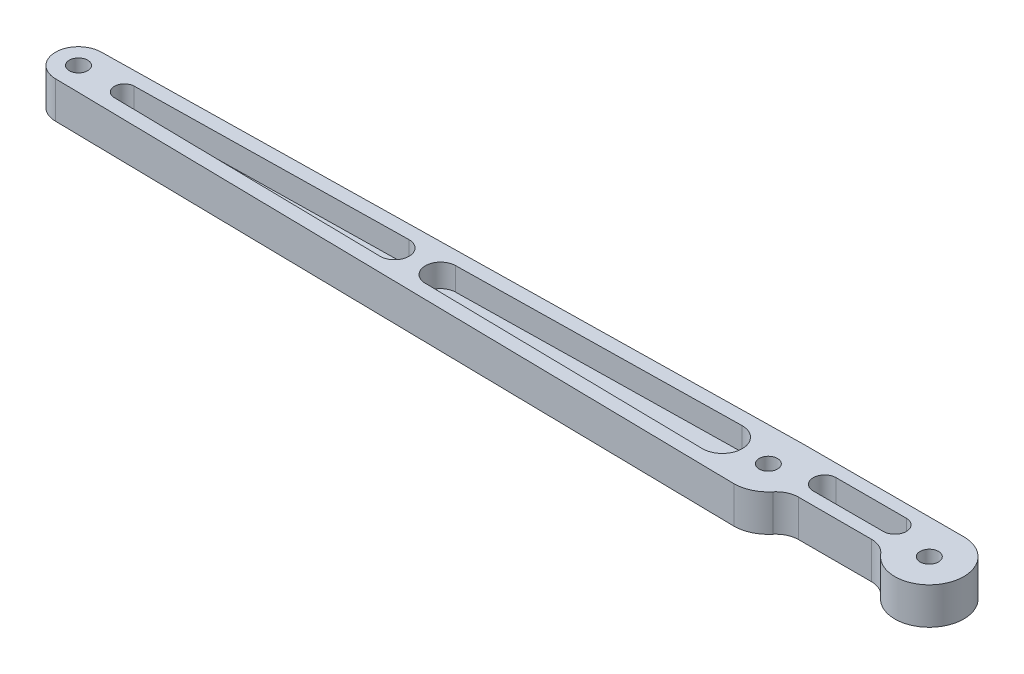
from build123d import *

# Parameters (mm, degrees)
SKETCH1_R           = 2
BOSS_EXTRUDE1_DEPTH = 8
CUT_EXTRUDE1_DEPTH  = 5


with BuildPart() as part:
    # Sketch1 → Boss-Extrude1 (new body)
    with BuildSketch(Plane(origin=(0, 0, 0), x_dir=(1, 0, 0), z_dir=(0, 1, 0))):
        with BuildLine():
            Line((121.34297014, 11.1299482), (86.34297014, 11.1299482))
            Line((86.34297014, 11.1299482), (-63.65702986, 8.6299482))
            ThreePointArc((-63.65702986, 8.6299482), (-68.65702986, 3.6299482), (-63.65702986, -1.3700518))
            Line((-63.65702986, -1.3700518), (86.34297014, -3.8700518))
            ThreePointArc((86.34297014, -3.8700518), (89.524950656, -3.161590654), (92.105781954, -1.1700518))
            ThreePointArc((92.105781954, -1.1700518), (93.826336153, 0.157640769), (95.947656497, 0.6299482))
            Line((95.947656497, 0.6299482), (111.738283784, 0.6299482))
            ThreePointArc((111.738283784, 0.6299482), (113.859604128, 0.157640769), (115.580158327, -1.1700518))
            ThreePointArc((115.580158327, -1.1700518), (118.160989625, -3.161590654), (121.34297014, -3.8700518))
            ThreePointArc((121.34297014, -3.8700518), (125.450889322, -2.645001999), (128.216833683, 0.6299482))
            ThreePointArc((128.216833683, 0.6299482), (127.617920339, 7.737867381), (121.34297014, 11.1299482))
        make_face()
        with Locations(Location((-63.65702986, 3.6299482, 0), (0, 0, 270))):
            Circle(SKETCH1_R, mode=Mode.SUBTRACT)
        with Locations(Location((86.34297014, 3.6299482, 0), (0, 0, 270))):
            Circle(SKETCH1_R, mode=Mode.SUBTRACT)
        with Locations(Location((121.34297014, 3.6299482, 0), (0, 0, 270))):
            Circle(SKETCH1_R, mode=Mode.SUBTRACT)
    extrude(amount=BOSS_EXTRUDE1_DEPTH)

    # Sketch2 → Cut-Extrude1 (cut)
    with BuildSketch(Plane(origin=(0, 8, 0), x_dir=(1, 0, 0), z_dir=(0, 1, 0))):
        with BuildLine():
            Line((-53.693130943, 5.796013182), (5.024715148, 6.77464395))
            ThreePointArc((5.024715148, 6.77464395), (8.222259227, 3.6299482), (5.024715148, 0.48525245))
            Line((5.024715148, 0.48525245), (-53.693130943, 1.463883218))
            ThreePointArc((-53.693130943, 1.463883218), (-55.823395663, 3.6299482), (-53.693130943, 5.796013182))
        make_face()
        with BuildLine():
            Line((96.34297014, 8.3799482), (111.599382505, 8.3799482))
            ThreePointArc((111.599382505, 8.3799482), (114.099382505, 5.8799482), (111.599382505, 3.3799482))
            Line((111.599382505, 3.3799482), (96.34297014, 3.3799482))
            ThreePointArc((96.34297014, 3.3799482), (93.84297014, 5.8799482), (96.34297014, 8.3799482))
        make_face()
        with BuildLine():
            Line((15.021938142, 6.941264333), (76.270767974, 7.962078164))
            ThreePointArc((76.270767974, 7.962078164), (80.675701747, 3.6299482), (76.270767974, -0.702181764))
            Line((76.270767974, -0.702181764), (15.021938142, 0.318632067))
            ThreePointArc((15.021938142, 0.318632067), (11.765350737, 3.6299482), (15.021938142, 6.941264333))
        make_face()
    extrude(amount=-CUT_EXTRUDE1_DEPTH, mode=Mode.SUBTRACT)


solid = part.part
